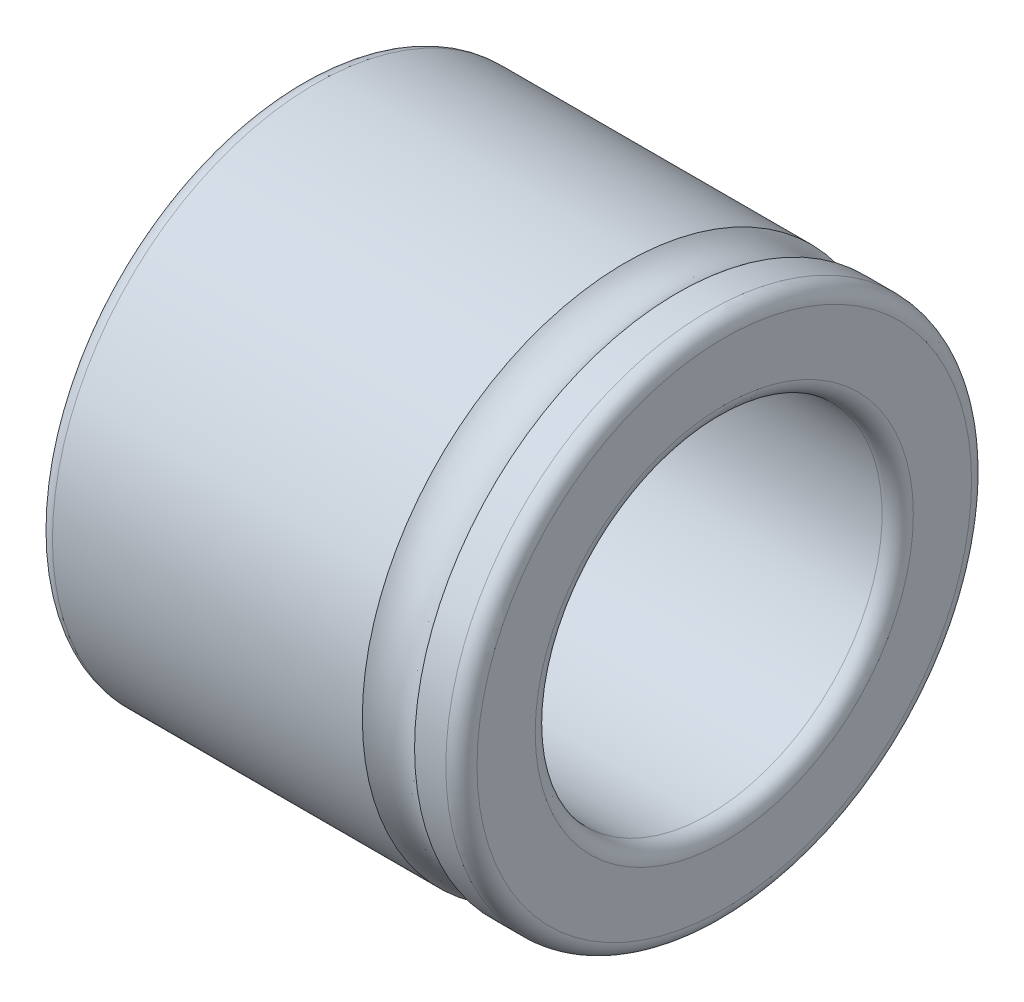
from build123d import *


with BuildPart() as part:
    # Sketch1 → Revolve1 (revolve)
    with BuildSketch(Plane.XY, mode=Mode.PRIVATE) as revolve1_sk:
        with BuildLine():
            Line((-18.526771459, 11.1125), (6.673228541, 11.1125))
            ThreePointArc((6.673228541, 11.1125), (7.380335322, 11.405393219), (7.673228541, 12.1125))
            Line((7.673228541, 12.1125), (7.673228541, 15.8425))
            ThreePointArc((7.673228541, 15.8425), (7.380335322, 16.549606781), (6.673228541, 16.8425))
            Line((6.673228541, 16.8425), (4.673228541, 16.8425))
            ThreePointArc((4.673228541, 16.8425), (3, 16.2), (1.326771459, 16.8425))
            Line((1.326771459, 16.8425), (-18.526771459, 16.8425))
            ThreePointArc((-18.526771459, 16.8425), (-19.23387824, 16.549606781), (-19.526771459, 15.8425))
            Line((-19.526771459, 15.8425), (-19.526771459, 12.1125))
            ThreePointArc((-19.526771459, 12.1125), (-19.23387824, 11.405393219), (-18.526771459, 11.1125))
        make_face()
    revolve(revolve1_sk.sketch.rotate(Axis((-23.316056516, 0, 0), (1, 0, 0)), 90), axis=Axis((-23.316056516, 0, 0), (1, 0, 0)))


solid = part.part
